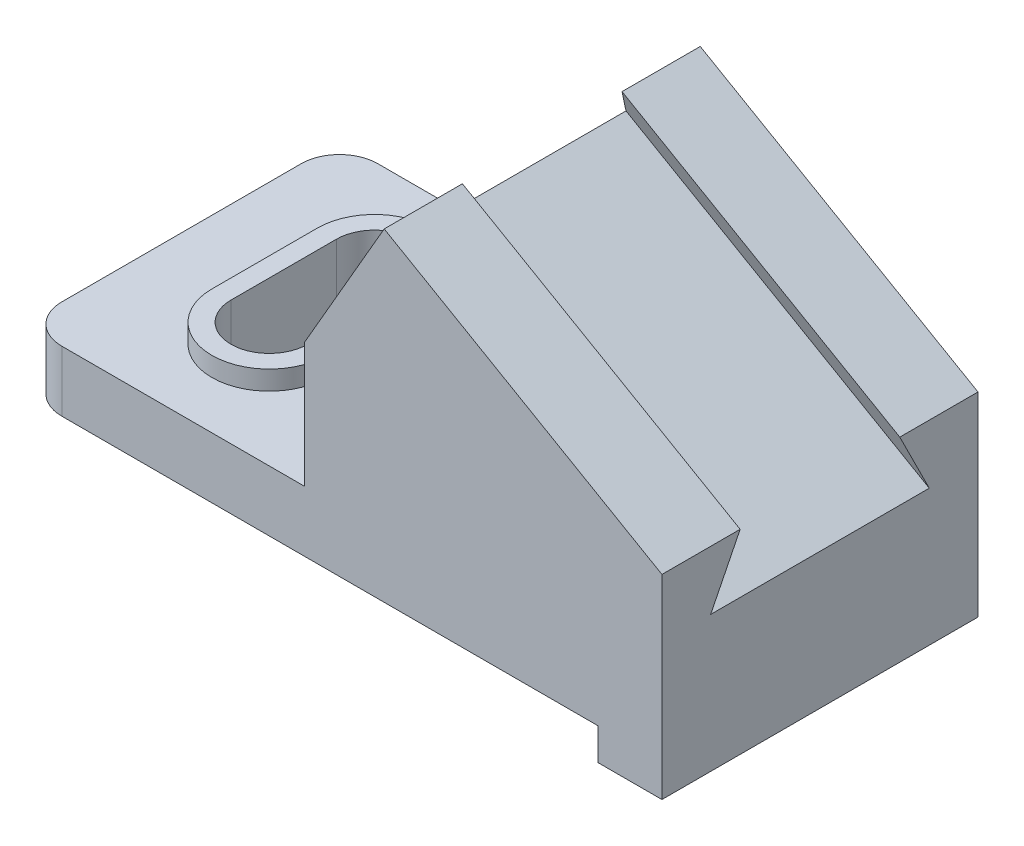
from build123d import *

# Parameters (mm, degrees)
BOSS_EXTRUDE1_DEPTH = 24.75
BOSS_EXTRUDE2_DEPTH = 3
CUT_EXTRUDE1_DEPTH  = 111.932129109
CUT_EXTRUDE2_DEPTH  = 109.046199668
FILLET1_R           = 6


with BuildPart() as part:
    # Sketch1 → Boss-Extrude1 (new, symmetric)
    with BuildSketch(Plane.XY):
        Polygon((44, 34), (56.5, 55.650635095), (100, 30.535898385), (100, 21.035898385), (100, 0), (90, 0), (90, 5), (44, 5), (6, 5), (0, 5), (0, 14.5), (6, 14.5), (44, 14.5), align=None)
    extrude(amount=BOSS_EXTRUDE1_DEPTH, both=True)

    # Sketch2 → Boss-Extrude2 (add)
    with BuildSketch(Plane(origin=(0, 14.5, 0), x_dir=(1, 0, 0), z_dir=(0, 1, 0))):
        with BuildLine():
            Line((31, 8.25), (31, -8.25))
            ThreePointArc((31, -8.25), (22, -17.25), (13, -8.25))
            Line((13, -8.25), (13, 8.25))
            ThreePointArc((13, 8.25), (22, 17.25), (31, 8.25))
        make_face()
        with BuildLine():
            Line((28, 8.25), (28, -8.25))
            ThreePointArc((28, -8.25), (22, -14.25), (16, -8.25))
            Line((16, -8.25), (16, 8.25))
            ThreePointArc((16, 8.25), (22, 14.25), (28, 8.25))
        make_face(mode=Mode.SUBTRACT)
    extrude(amount=BOSS_EXTRUDE2_DEPTH)

    # Sketch3 → Cut-Extrude1 (cut, through all)
    with BuildSketch(Plane(origin=(0, 14.5, 0), x_dir=(1, 0, 0), z_dir=(0, 1, 0))):
        with BuildLine():
            Line((28, -8.25), (28, 8.25))
            ThreePointArc((28, 8.25), (22, 14.25), (16, 8.25))
            Line((16, 8.25), (16, -8.25))
            ThreePointArc((16, -8.25), (22, -14.25), (28, -8.25))
        make_face()
    extrude(amount=-CUT_EXTRUDE1_DEPTH, mode=Mode.SUBTRACT)

    # Sketch4 → Cut-Extrude2 (cut, through all)
    with BuildSketch(Plane(origin=(18.277568136, -10.552558883, 0), x_dir=(0, 0, 1), z_dir=(-0.8660254037844386, 0.5000000000000001, 0))):
        Polygon((-12.5, 76.444863729), (12.5, 76.444863729), (17.118802154, 68.444863729), (-17.118802154, 68.444863729), align=None)
    extrude(amount=-CUT_EXTRUDE2_DEPTH, mode=Mode.SUBTRACT)

    # Fillet1
    fillet1_edges = [part.edges().sort_by_distance(p)[0] for p in [
        (0, 9.75, -24.75),
        (0, 9.75, 24.75),
    ]]
    fillet(fillet1_edges, radius=FILLET1_R)


solid = part.part
